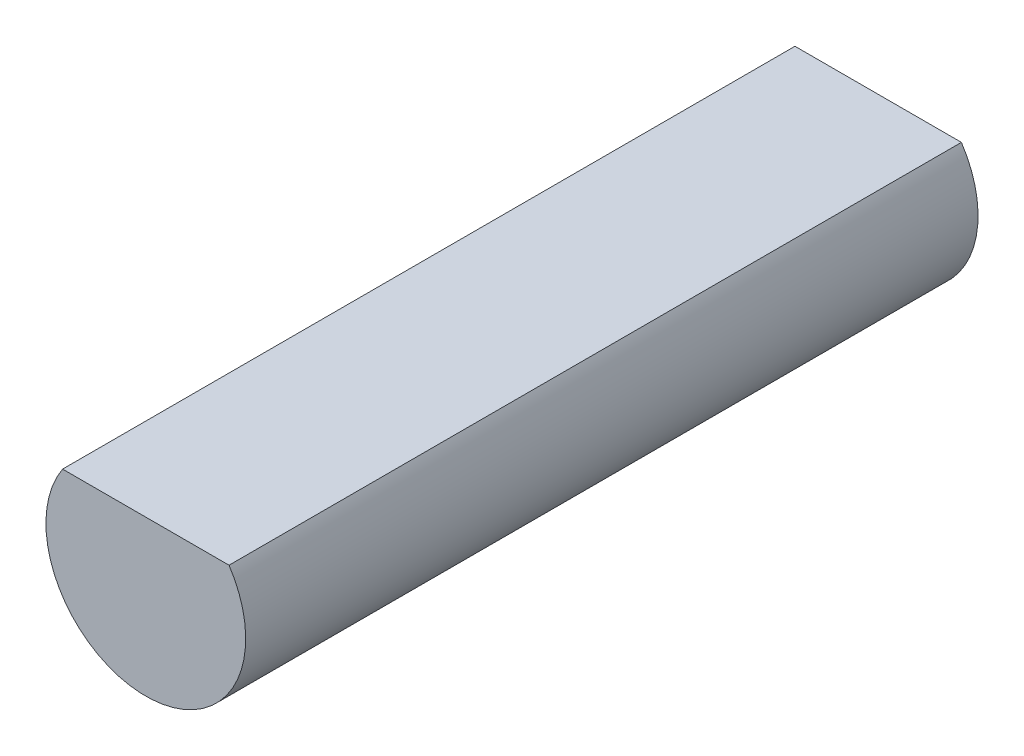
from build123d import *

# Parameters (mm, degrees)
EXTRUDE_1_DEPTH = 22


with BuildPart() as part:
    # 草图1 → 凸台-拉伸1 (new body)
    with BuildSketch(Plane.XY):
        with BuildLine():
            Line((2.5, 1.658312395), (-2.5, 1.658312395))
            ThreePointArc((-2.5, 1.658312395), (-0.866025404, -2.872281323), (3, 0))
            ThreePointArc((3, 0), (2.872281323, 0.866025404), (2.5, 1.658312395))
        make_face()
    extrude(amount=EXTRUDE_1_DEPTH)


solid = part.part
